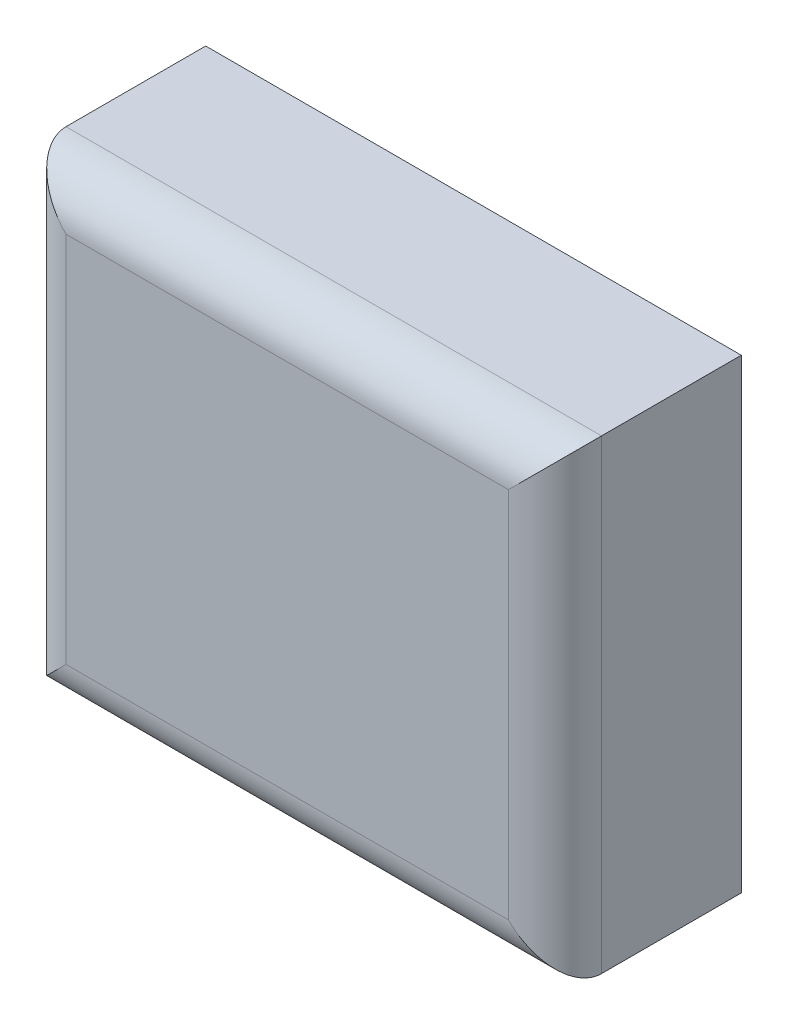
from build123d import *

# Parameters (mm, degrees)
SKETCH_1_W      = 11.5
SKETCH_1_H      = 10
EXTRUDE_1_DEPTH = 4
FILLET_2_R      = 1


with BuildPart() as part:
    # 草图1 → 凸台-拉伸1 (new body)
    with BuildSketch(Plane.XY):
        Rectangle(SKETCH_1_W, SKETCH_1_H)
    extrude(amount=EXTRUDE_1_DEPTH)

    # 圆角2
    fillet_2_edges = [part.edges().sort_by_distance(p)[0] for p in [
        (5.75, 0, 4),
        (0, 5, 4),
        (-5.75, 0, 4),
        (0, -5, 4),
    ]]
    fillet(fillet_2_edges, radius=FILLET_2_R)


solid = part.part
